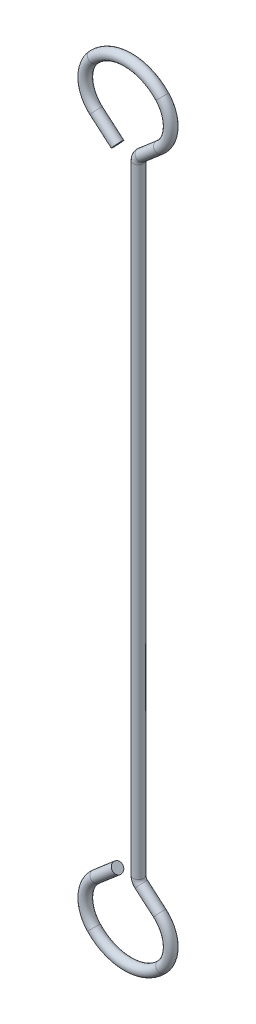
from build123d import *

# Parameters (mm, degrees)
SWEEP1_PROFILE_R = 0.125


with BuildPart() as part:
    # Sweep1: sweep along a path in Sketch1
    with BuildLine(Plane.XY) as sweep1_path:
        Line((-0.5, 7.5), (-1.010868725, 7.937887479))
        ThreePointArc((-1.010868725, 7.937887479), (-1.271724054, 8.46763603), (-1.068325585, 9.021989791))
        ThreePointArc((-1.068325585, 9.021989791), (-0.25, 9.375), (0.568325585, 9.021989791))
        ThreePointArc((0.568325585, 9.021989791), (0.771724054, 8.46763603), (0.510868725, 7.937887479))
        Line((0.510868725, 7.937887479), (0.069841725, 7.559864336))
        ThreePointArc((0.069841725, 7.559864336), (0.01829742, 7.491584377), (0, 7.408013016))
        Line((0, 7.408013016), (0, -7.408013016))
        ThreePointArc((0, -7.408013016), (0.01829742, -7.491584377), (0.069841725, -7.559864336))
        Line((0.069841725, -7.559864336), (0.510868725, -7.937887479))
        ThreePointArc((0.510868725, -7.937887479), (0.771724054, -8.46763603), (0.568325585, -9.021989791))
        ThreePointArc((0.568325585, -9.021989791), (-0.25, -9.375), (-1.068325585, -9.021989791))
        ThreePointArc((-1.068325585, -9.021989791), (-1.271724054, -8.46763603), (-1.010868725, -7.937887479))
        Line((-1.010868725, -7.937887479), (-0.5, -7.5))
    # Sweep1 profile (on start of the path) → Sweep1 (sweep)
    with BuildSketch(Plane(origin=(-0.5, 7.5, 0), x_dir=(-0.6507913734559683, -0.7592566023652969, 0), z_dir=(-0.7592566023652969, 0.6507913734559683, 0))):
        Circle(SWEEP1_PROFILE_R)
    sweep(path=sweep1_path.line)


solid = part.part
